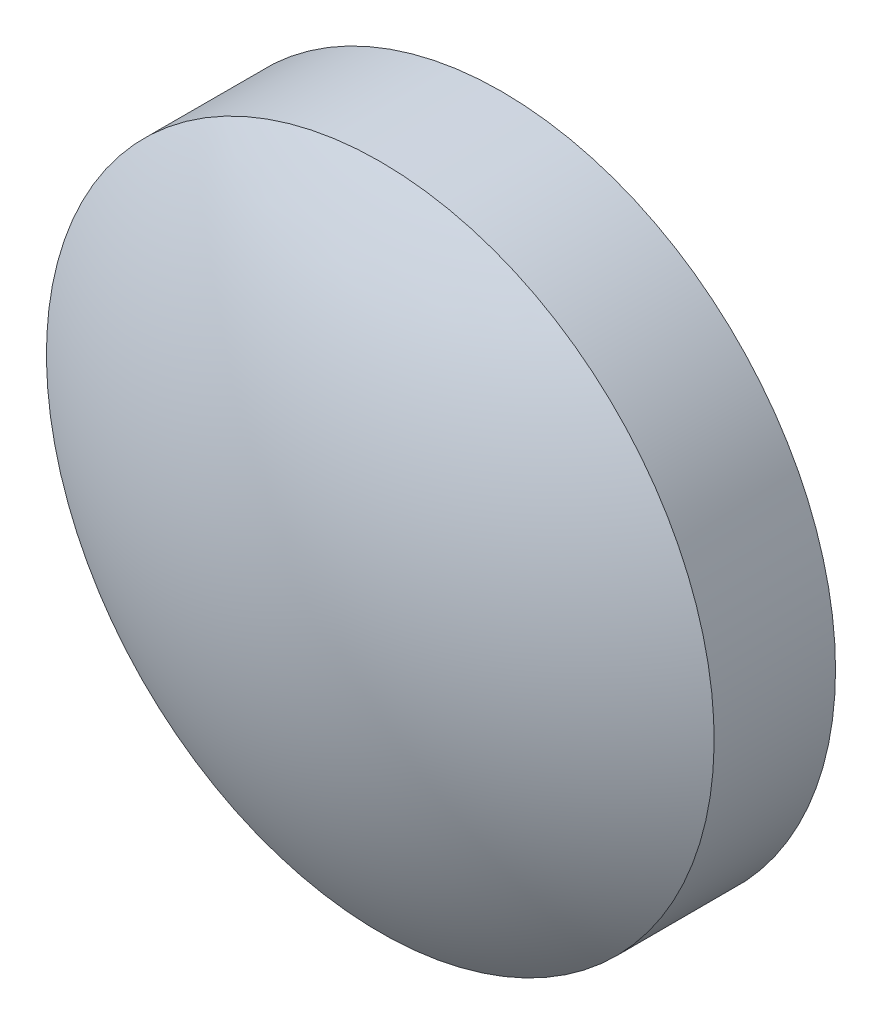
from build123d import *


with BuildPart() as part:
    # Sketch3 → Revolve1 (revolve)
    with BuildSketch(Plane(origin=(0, 0, 0), x_dir=(0, 0, -1), z_dir=(1, 0, 0))):
        with BuildLine():
            Line((0, 2.75), (0, 0))
            Line((0, 0), (1.324176728, 0))
            ThreePointArc((1.324176728, 0), (1.11370261, 1.435423916), (0.5, 2.75))
            Line((0.5, 2.75), (0, 2.75))
        make_face()
        with BuildLine():
            ThreePointArc((-0.5, 2.75), (-1.11370261, 1.435423916), (-1.324176728, 0))
            Line((-1.324176728, 0), (0, 0))
            Line((0, 0), (0, 2.75))
            Line((0, 2.75), (-0.5, 2.75))
        make_face()
    revolve(axis=Axis((0, 0, 0), (0, 0, 1)))


solid = part.part
